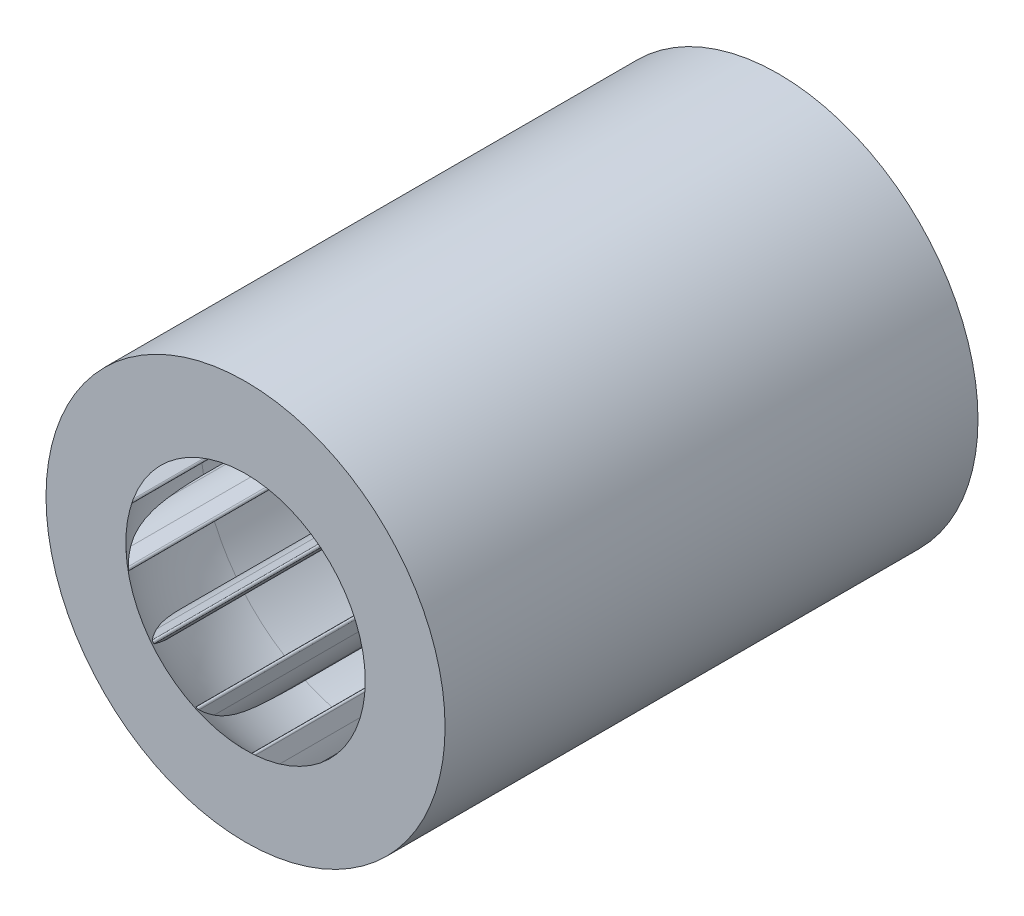
from build123d import *

# Parameters (mm, degrees)
EXTRUDE_1_DEPTH          = 66.77051
PATTERN_CIRCULAR_1_COUNT = 14


with BuildPart() as part:
    # 草图2 → 旋转1 (revolve)
    with BuildSketch(Plane(origin=(0, 0, 0), x_dir=(0, 0, -1), z_dir=(1, 0, 0)), mode=Mode.PRIVATE) as revolve_1_sk:
        with BuildLine():
            Line((16.770509831, 22.5), (66.770509831, 22.5))
            Line((66.770509831, 22.5), (66.770509831, 25))
            Line((66.770509831, 25), (0, 25))
            Line((0, 25), (0, 15))
            ThreePointArc((0, 15), (7.584923296, 20.539595906), (16.770509831, 22.5))
        make_face()
    revolve(revolve_1_sk.sketch.rotate(Axis((0, 0, 0), (0, 0, -1)), 90), axis=Axis((0, 0, 0), (0, 0, -1)))

    # 草图3 → 凸台-拉伸1 (add, through all)
    with BuildSketch(Plane.XY):
        with BuildLine():
            Line((-0.196116135, -15.980580676), (-0.60776773, -18.038838649))
            ThreePointArc((-0.60776773, -18.038838649), (-0.801960973, -20), (-0.60776773, -21.961161351))
            Line((-0.60776773, -21.961161351), (-0.196116135, -24.019419324))
            ThreePointArc((-0.196116135, -24.019419324), (0, -24.180196097), (0.196116135, -24.019419324))
            Line((0.196116135, -24.019419324), (0.60776773, -21.961161351))
            ThreePointArc((0.60776773, -21.961161351), (0.801960973, -20), (0.60776773, -18.038838649))
            Line((0.60776773, -18.038838649), (0.196116135, -15.980580676))
            ThreePointArc((0.196116135, -15.980580676), (0, -15.819803903), (-0.196116135, -15.980580676))
        make_face()
    extrude_1 = extrude(amount=-EXTRUDE_1_DEPTH)

    # 阵列(圆周)1: 凸台-拉伸1 ×14 about axis
    pattern_circular_1_axis = Axis((0, 0, 0), (0, 0, 1))
    for i in range(1, PATTERN_CIRCULAR_1_COUNT):
        add(extrude_1.rotate(pattern_circular_1_axis, i * 360 / PATTERN_CIRCULAR_1_COUNT))


solid = part.part
